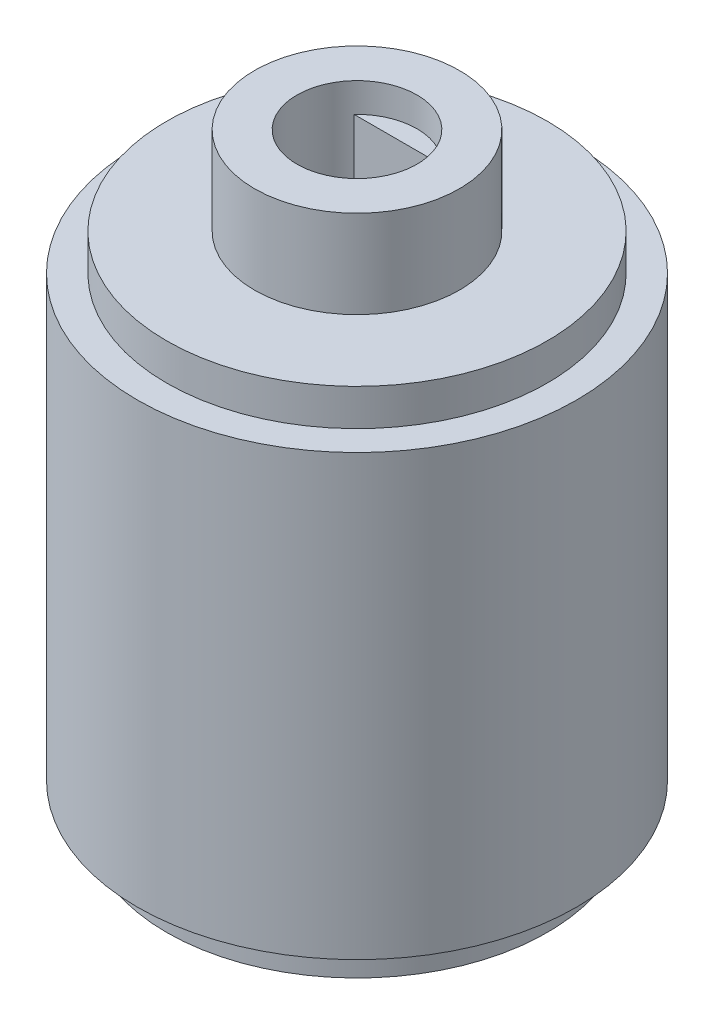
from build123d import *
from build123d.topology import SkipClean

# Parameters (mm, degrees)
SKETCH1_R           = 15
BOSS_EXTRUDE1_DEPTH = 60
CUT_EXTRUDE1_START  = -2.5
SKETCH2_R           = 15
SKETCH2_R_2         = 13
CUT_EXTRUDE1_DEPTH  = 2.5
SKETCH3_R           = 15
CUT_EXTRUDE2_DEPTH  = 25
SKETCH4_R           = 15
SKETCH4_R_2         = 13
CUT_EXTRUDE3_DEPTH  = 2.5
SKETCH6_R           = 2.870458913
BOSS_EXTRUDE2_DEPTH = 9.5
SKETCH7_R           = 7
BOSS_EXTRUDE3_DEPTH = 2
SKETCH8_R           = 19
CUT_EXTRUDE4_DEPTH  = 43.649736224
CUT_EXTRUDE5_DEPTH  = 43.649736224
SKETCH10_R          = 7
BOSS_EXTRUDE4_DEPTH = 2
CUT_EXTRUDE6_DEPTH  = 45.395945761
SKETCH12_R          = 7
BOSS_EXTRUDE5_DEPTH = 2
CUT_EXTRUDE7_DEPTH  = 47.16275555
CUT_EXTRUDE8_START  = -2
SKETCH14_R          = 4.1
CUT_EXTRUDE8_DEPTH  = 2


with BuildPart() as part:
    # Sketch1 → Boss-Extrude1 (new body)
    with BuildSketch(Plane(origin=(0, 0, 0), x_dir=(1, 0, 0), z_dir=(0, 1, 0))):
        with Locations(Location((0, 0, 0), (0, 0, 270))):
            Circle(SKETCH1_R)
    extrude(amount=BOSS_EXTRUDE1_DEPTH)

    # Sketch2 → Cut-Extrude1 (cut)
    with BuildSketch(Plane(origin=(0, 60, 0), x_dir=(1, 0, 0), z_dir=(0, 1, 0)).offset(CUT_EXTRUDE1_START)):
        with Locations(Location((0, 0, 0), (0, 0, 270))):
            Circle(SKETCH2_R)
        with Locations(Location((0, 0, 0), (0, 0, 270))):
            Circle(SKETCH2_R_2, mode=Mode.SUBTRACT)
    extrude(amount=CUT_EXTRUDE1_DEPTH, mode=Mode.SUBTRACT)

    # Sketch3 → Cut-Extrude2 (cut)
    with BuildSketch(Plane.XZ):
        with Locations(Location((0, 0, 0), (0, 0, 270))):
            Circle(SKETCH3_R)
    extrude(amount=-CUT_EXTRUDE2_DEPTH, mode=Mode.SUBTRACT)

    # Sketch4 → Cut-Extrude3 (cut)
    with BuildSketch(Plane.XZ.offset(-25)):
        with Locations(Location((0, 0, 0), (0, 0, 270))):
            Circle(SKETCH4_R)
        with Locations(Location((0, 0, 0), (0, 0, 90))):
            Circle(SKETCH4_R_2, mode=Mode.SUBTRACT)
    extrude(amount=-CUT_EXTRUDE3_DEPTH, mode=Mode.SUBTRACT)

    # Sketch6 → Boss-Extrude2 (add)
    with BuildSketch(Plane.XZ.offset(-25)):
        with Locations(Location((0, 0, 0), (0, 0, 270))):
            Circle(SKETCH6_R)
    extrude(amount=BOSS_EXTRUDE2_DEPTH)

    # Sketch7 → Boss-Extrude3 (add)
    with BuildSketch(Plane(origin=(0, 60, 0), x_dir=(1, 0, 0), z_dir=(0, 1, 0))):
        with Locations(Location((0, 0, 0), (0, 0, 270))):
            Circle(SKETCH7_R)
    extrude(amount=BOSS_EXTRUDE3_DEPTH)

    # Sketch8 → Cut-Extrude4 (cut, through all)
    with BuildSketch(Plane.XZ.offset(-25)):
        Circle(SKETCH8_R)
    extrude(amount=CUT_EXTRUDE4_DEPTH, mode=Mode.SUBTRACT)

    # Sketch9 → Cut-Extrude5 (cut, through all)
    with BuildSketch(Plane(origin=(0, 62, 0), x_dir=(1, 0, 0), z_dir=(0, 1, 0))):
        with BuildLine():
            ThreePointArc((-2.994995826, 2.8), (-3.760983914, -1.632482772), (0, -4.1))
            Line((0, -4.1), (0, 2.8))
            Line((0, 2.8), (-2.994995826, 2.8))
        make_face()
        with BuildLine():
            Line((0, 2.8), (0, -4.1))
            ThreePointArc((0, -4.1), (3.760983914, -1.632482772), (2.994995826, 2.8))
            Line((2.994995826, 2.8), (0, 2.8))
        make_face()
    extrude(amount=-CUT_EXTRUDE5_DEPTH, mode=Mode.SUBTRACT)

    # Sketch10 → Boss-Extrude4 (add)
    with BuildSketch(Plane(origin=(0, 62, 0), x_dir=(1, 0, 0), z_dir=(0, 1, 0))):
        with Locations(Location((0, 0, 0), (0, 0, 270))):
            Circle(SKETCH10_R)
    extrude(amount=BOSS_EXTRUDE4_DEPTH)

    # Sketch11 → Cut-Extrude6 (cut, through all)
    with SkipClean():  # the faces are left unmerged after this step: merging them gives an invalid solid
        with BuildSketch(Plane.XZ.offset(-25)):
            with BuildLine():
                Line((-2.994995826, -2.8), (2.994995826, -2.8))
                ThreePointArc((2.994995826, -2.8), (0, 4.1), (-2.994995826, -2.8))
            make_face()
        extrude(amount=-CUT_EXTRUDE6_DEPTH, mode=Mode.SUBTRACT)

    # Sketch12 → Boss-Extrude5 (add)
    with SkipClean():  # the faces are left unmerged after this step: merging them gives an invalid solid
        with BuildSketch(Plane(origin=(0, 64, 0), x_dir=(1, 0, 0), z_dir=(0, 1, 0))):
            with Locations(Location((0, 0, 0), (0, 0, 270))):
                Circle(SKETCH12_R)
        extrude(amount=BOSS_EXTRUDE5_DEPTH)

    # Sketch13 → Cut-Extrude7 (cut, through all)
    with SkipClean():  # the faces are left unmerged after this step: merging them gives an invalid solid
        with BuildSketch(Plane.XZ.offset(-25)):
            with BuildLine():
                Line((-2.994995826, -2.8), (2.994995826, -2.8))
                ThreePointArc((2.994995826, -2.8), (0, 4.1), (-2.994995826, -2.8))
            make_face()
        extrude(amount=-CUT_EXTRUDE7_DEPTH, mode=Mode.SUBTRACT)

    # Sketch14 → Cut-Extrude8 (cut)
    with SkipClean():  # the faces are left unmerged after this step: merging them gives an invalid solid
        with BuildSketch(Plane(origin=(0, 66, 0), x_dir=(1, 0, 0), z_dir=(0, 1, 0)).offset(CUT_EXTRUDE8_START)):
            with Locations(Location((0, 0, 0), (0, 0, 136.927218653))):
                Circle(SKETCH14_R)
        extrude(amount=CUT_EXTRUDE8_DEPTH, mode=Mode.SUBTRACT)


solid = part.part
